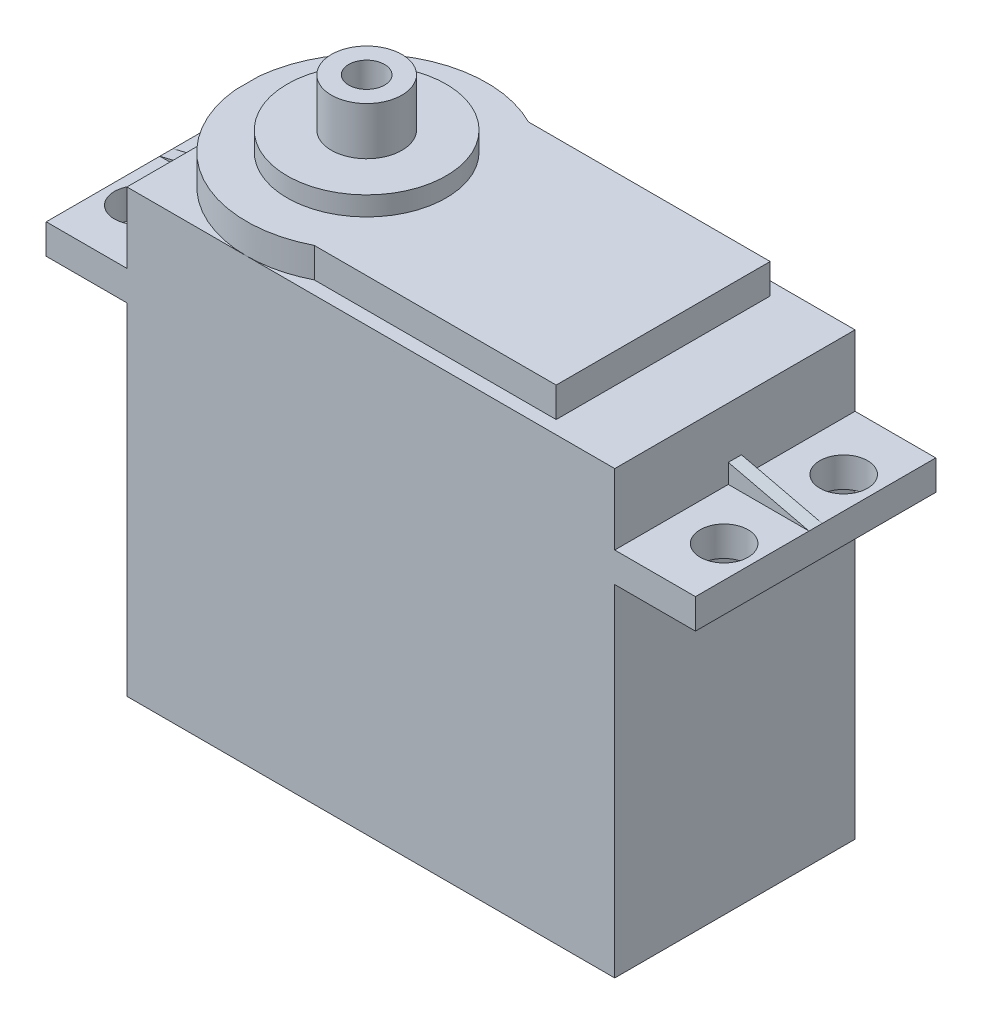
from build123d import *

# Parameters (mm, degrees)
ESQUISSE1_W                       = 40.8
ESQUISSE1_H                       = 39.4
ESQUISSE1_W_2                     = 6.75
ESQUISSE1_H_2                     = 2.5
BOSS_EXTRU_1_DEPTH                = 10.05
DIAM_TRE_DU_PER_AGE_4_0_4_1_D     = 4
BOSS_EXTRU_3_DEPTH                = 0.55
ESQUISSE6_R                       = 6.65
BOSS_EXTRU_4_DEPTH                = 1.6
ESQUISSE4_R                       = 2.95
BOSS_EXTRU_2_DEPTH                = 4
DIAM_TRE_DU_PER_AGE_3_0_3_1_D     = 3
DIAM_TRE_DU_PER_AGE_3_0_3_1_DEPTH = 6
DIAM_TRE_DU_PER_AGE_3_0_3_1_TIP   = 0.901290929
ENL_V_MAT_EXTRU_1_DEPTH           = 2.5
ESQUISSE8_W                       = 7
ESQUISSE8_H                       = 4.2
BOSS_EXTRU_5_DEPTH                = 4.7
ESQUISSE9_R                       = 0.7
BOSS_EXTRU_6_DEPTH                = 3


with BuildPart() as part:
    # Esquisse1 → Boss.-Extru.1 (new, symmetric)
    with BuildSketch(Plane.XY):
        with Locations((0, -8.8)):
            Rectangle(ESQUISSE1_W, ESQUISSE1_H)
        with Locations((-23.775, 1.25)):
            Rectangle(ESQUISSE1_W_2, ESQUISSE1_H_2)
        with Locations((23.775, 1.25)):
            Rectangle(ESQUISSE1_W_2, ESQUISSE1_H_2)
    extrude(amount=BOSS_EXTRU_1_DEPTH, both=True)

    # Diamètre du perçage Ø4.0 (4)1 (through all)
    with Locations(Plane(origin=(0, 2.5, 0), x_dir=(1, 0, 0), z_dir=(0, 1, 0))):
        with Locations((-24.5, 5), (24.5, 5), (24.5, -5), (-24.5, -5)):
            Hole(DIAM_TRE_DU_PER_AGE_4_0_4_1_D / 2)

    # Esquisse5 → Boss.-Extru.3 (add, symmetric)
    with BuildSketch(Plane.XY):
        Polygon((-20.4, 4.1), (-27.15, 2.5), (-20.4, 2.5), align=None)
        Polygon((20.4, 2.5), (20.4, 4.1), (27.15, 2.5), align=None)
    extrude(amount=BOSS_EXTRU_3_DEPTH, both=True)

    # Esquisse6 → Boss.-Extru.4 (add)
    with BuildSketch(Plane(origin=(0, 10.9, 0), x_dir=(1, 0, 0), z_dir=(0, 1, 0))):
        with Locations(Location((-10.4, 0, 0), (0, 0, 180))):
            Circle(ESQUISSE6_R)
    extrude(amount=BOSS_EXTRU_4_DEPTH)

    # Esquisse4 → Boss.-Extru.2 (add)
    with BuildSketch(Plane(origin=(0, 12.5, 0), x_dir=(1, 0, 0), z_dir=(0, 1, 0))):
        with Locations(Location((-10.4, 0, 0), (0, 0, 180))):
            Circle(ESQUISSE4_R)
    extrude(amount=BOSS_EXTRU_2_DEPTH)

    # Diamètre du perçage Ø3.0 (3)1
    with Locations(Plane(origin=(0, 16.5, 0), x_dir=(1, 0, 0), z_dir=(0, 1, 0))):
        with Locations((-10.4, 0)):
            Hole(DIAM_TRE_DU_PER_AGE_3_0_3_1_D / 2, depth=DIAM_TRE_DU_PER_AGE_3_0_3_1_DEPTH)
            with Locations((0, 0, -(DIAM_TRE_DU_PER_AGE_3_0_3_1_DEPTH + DIAM_TRE_DU_PER_AGE_3_0_3_1_TIP / 2))):  # 118° drill point
                Cone(0, DIAM_TRE_DU_PER_AGE_3_0_3_1_D / 2, DIAM_TRE_DU_PER_AGE_3_0_3_1_TIP, mode=Mode.SUBTRACT)

    # Esquisse7 → Enlèv. mat.-Extru.1 (cut)
    with BuildSketch(Plane(origin=(0, 10.9, 0), x_dir=(1, 0, 0), z_dir=(0, 1, 0))):
        with BuildLine():
            ThreePointArc((-20.4, 1.00124922), (-17.143142641, 7.452014984), (-10.4, 10.05))
            Line((-10.4, 10.05), (-20.4, 10.05))
            Line((-20.4, 10.05), (-20.4, 1.00124922))
        make_face()
        with BuildLine():
            Line((-20.4, -10.05), (-10.4, -10.05))
            ThreePointArc((-10.4, -10.05), (-17.143142641, -7.452014984), (-20.4, -1.00124922))
            Line((-20.4, -1.00124922), (-20.4, -10.05))
        make_face()
        with BuildLine():
            ThreePointArc((-10.4, 10.05), (-8.048936411, 9.771130948), (-5.82834822, 8.95))
            Line((-5.82834822, 8.95), (14.4, 8.95))
            Line((14.4, 8.95), (14.4, -8.95))
            Line((14.4, -8.95), (-5.82834822, -8.95))
            ThreePointArc((-5.82834822, -8.95), (-8.048936411, -9.771130948), (-10.4, -10.05))
            Line((-10.4, -10.05), (20.4, -10.05))
            Line((20.4, -10.05), (20.4, 10.05))
            Line((20.4, 10.05), (-10.4, 10.05))
        make_face()
    extrude(amount=-ENL_V_MAT_EXTRU_1_DEPTH, mode=Mode.SUBTRACT)

    # Esquisse8 → Boss.-Extru.5 (add)
    with BuildSketch(Plane.ZY.offset(20.4)):
        with Locations((0, -22.6)):
            Rectangle(ESQUISSE8_W, ESQUISSE8_H)
    extrude(amount=BOSS_EXTRU_5_DEPTH)

    # Esquisse9 → Boss.-Extru.6 (add)
    with BuildSketch(Plane.ZY.offset(25.1)):
        with Locations((-1.5, -22.523764429)):
            Circle(ESQUISSE9_R)
        with Locations((0, -22.523764429)):
            Circle(ESQUISSE9_R)
        with Locations(Location((1.5, -22.523764429, 0), (0, 0, 180))):
            Circle(ESQUISSE9_R)
    extrude(amount=BOSS_EXTRU_6_DEPTH)


solid = part.part
